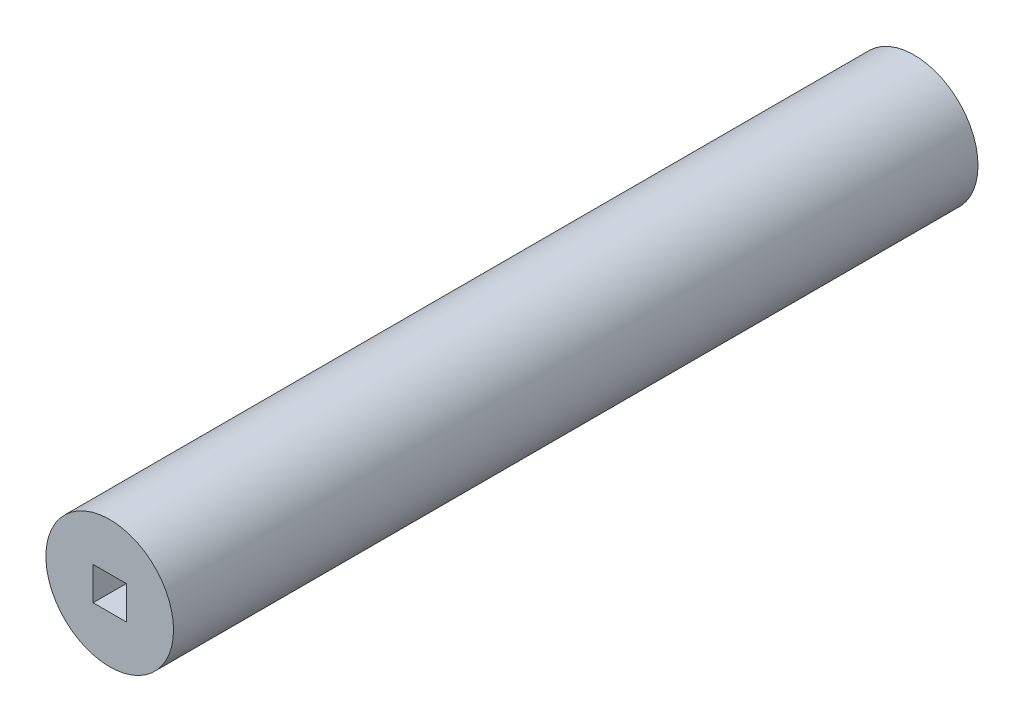
from build123d import *

# Parameters (mm, degrees)
ESQUISSE1_R             = 5.95
BOSS_EXTRU_1_DEPTH      = 75
ESQUISSE2_W             = 3.1
ESQUISSE2_H             = 3.1
ENL_V_MAT_EXTRU_1_DEPTH = 76.470557173


with BuildPart() as part:
    # Esquisse1 → Boss.-Extru.1 (new body)
    with BuildSketch(Plane.XY):
        Circle(ESQUISSE1_R)
    extrude(amount=BOSS_EXTRU_1_DEPTH)

    # Esquisse2 → Enlèv. mat.-Extru.1 (cut, through all)
    with BuildSketch(Plane(origin=(0, 0, 0), x_dir=(-1, 0, 0), z_dir=(0, 0, -1))):
        Rectangle(ESQUISSE2_W, ESQUISSE2_H)
    extrude(amount=-ENL_V_MAT_EXTRU_1_DEPTH, mode=Mode.SUBTRACT)


solid = part.part
